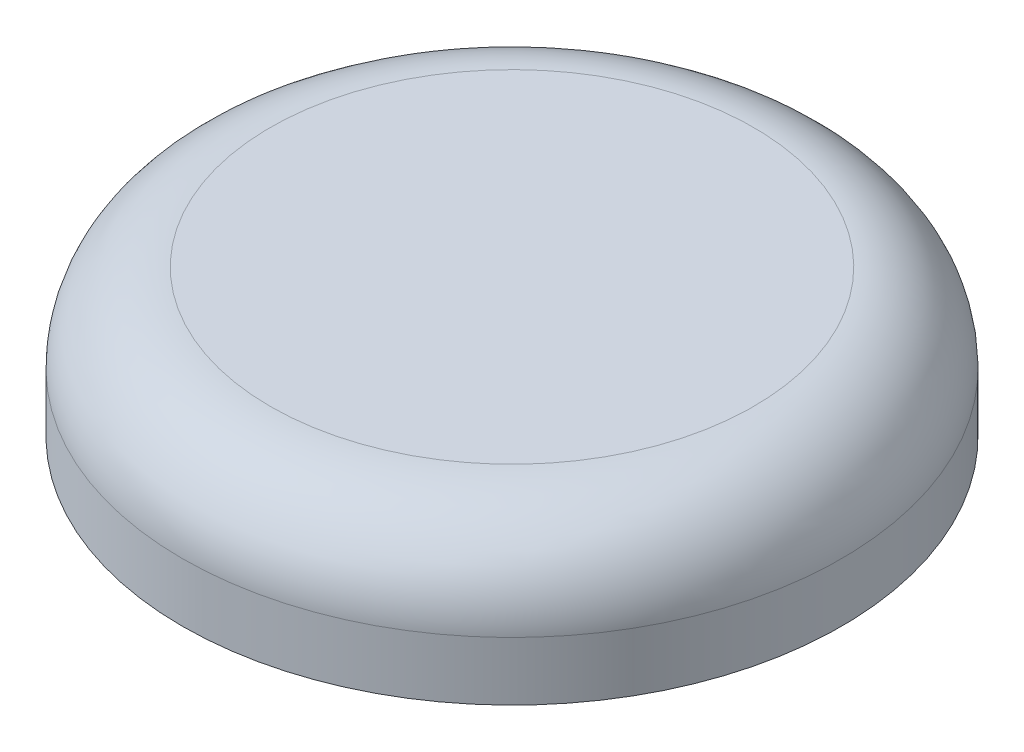
from build123d import *

# Parameters (mm, degrees)
SKETCH1_R           = 11.25
BOSS_EXTRUDE1_DEPTH = 5
FILLET1_R           = 3


with BuildPart() as part:
    # Sketch1 → Boss-Extrude1 (new body)
    with BuildSketch(Plane(origin=(0, 0, 0), x_dir=(1, 0, 0), z_dir=(0, 1, 0))):
        with Locations(Location((0, 0, 0), (0, 0, 270))):
            Circle(SKETCH1_R)
    extrude(amount=BOSS_EXTRUDE1_DEPTH)

    # Fillet1
    fillet1_edges = [part.edges().sort_by_distance(p)[0] for p in [
        (0, 5, -11.25),
    ]]
    fillet(fillet1_edges, radius=FILLET1_R)


solid = part.part
